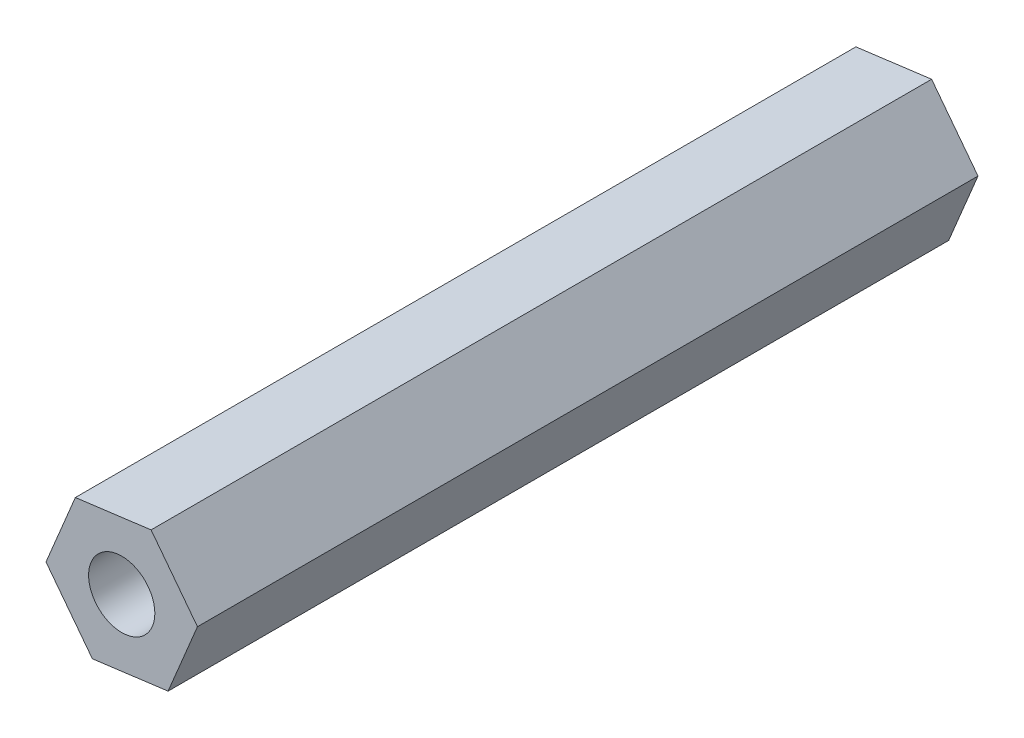
from build123d import *

# Parameters (mm, degrees)
SKETCH1_R           = 3.18
BOSS_EXTRUDE1_DEPTH = 74.95


with BuildPart() as part:
    # Sketch1 → Boss-Extrude1 (new body)
    with BuildSketch(Plane.XY):
        Polygon((7.271508307, 0.942602929), (2.819436071, 6.768612382), (-4.452072235, 5.826009453), (-7.271508307, -0.942602929), (-2.819436071, -6.768612382), (4.452072235, -5.826009453), align=None)
        Circle(SKETCH1_R, mode=Mode.SUBTRACT)
    extrude(amount=BOSS_EXTRUDE1_DEPTH)


solid = part.part
